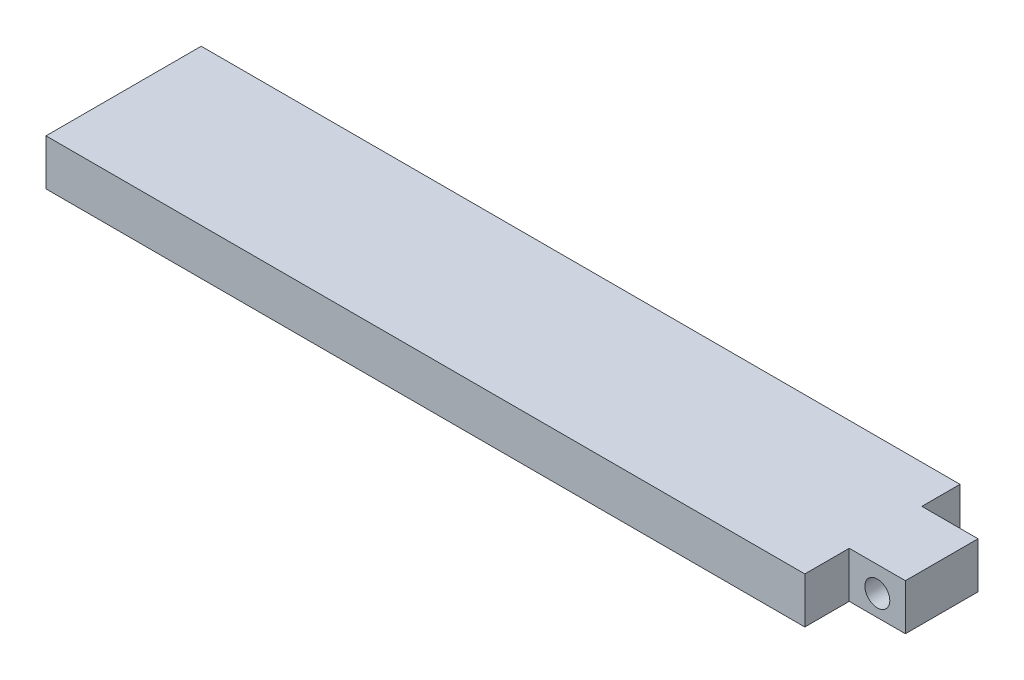
from build123d import *

# Parameters (mm, degrees)
BOSS_EXTRUDE1_DEPTH = 4
SKETCH2_R           = 1.084753974
CUT_EXTRUDE2_DEPTH  = 72.639384493


with BuildPart() as part:
    # Sketch1 → Boss-Extrude1 (new body)
    with BuildSketch(Plane(origin=(0, 0, 0), x_dir=(1, 0, 0), z_dir=(0, 1, 0))):
        Polygon((0, 13.498100823), (0, 0), (65.993726751, 0), (65.993726751, 3.864267846), (70.875882165, 3.864267846), (70.875882165, 10.179581308), (65.993726751, 10.179581308), (65.993726751, 13.498100823), align=None)
    extrude(amount=BOSS_EXTRUDE1_DEPTH)

    # Sketch2 → Cut-Extrude2 (cut, through all)
    with BuildSketch(Plane.XY.offset(-3.864267846)):
        with Locations((68.434804458, 1.817232477)):
            Circle(SKETCH2_R)
    extrude(amount=-CUT_EXTRUDE2_DEPTH, mode=Mode.SUBTRACT)


solid = part.part
